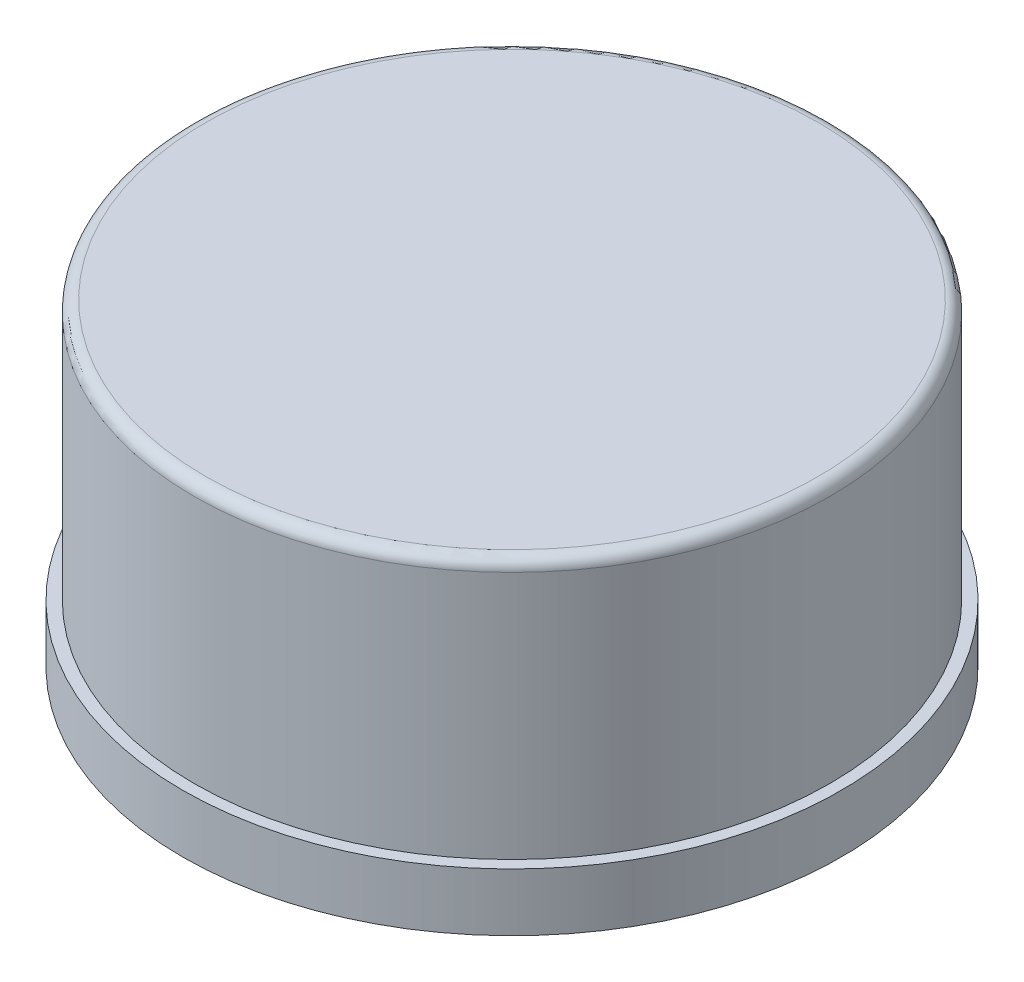
from build123d import *

# Parameters (mm, degrees)
SKETCH7_R           = 5.7
BOSS_EXTRUDE2_DEPTH = 1
SKETCH8_R           = 5.5
BOSS_EXTRUDE3_DEPTH = 4.5
FILLET4_R           = 0.2
SKETCH9_W           = 5
SKETCH9_H           = 5
BOSS_EXTRUDE4_DEPTH = 0.1
SHELL3_T            = -0.6


with BuildPart() as part:
    # Sketch7 → Boss-Extrude2 (new body)
    with BuildSketch(Plane(origin=(0, 0, 0), x_dir=(1, 0, 0), z_dir=(0, 1, 0))):
        with Locations(Location((0, 0, 0), (0, 0, 270))):
            Circle(SKETCH7_R)
    extrude(amount=BOSS_EXTRUDE2_DEPTH)

    # Sketch8 → Boss-Extrude3 (add)
    with BuildSketch(Plane(origin=(0, 1, 0), x_dir=(1, 0, 0), z_dir=(0, 1, 0))):
        with Locations(Location((0, 0, 0), (0, 0, 270))):
            Circle(SKETCH8_R)
    extrude(amount=BOSS_EXTRUDE3_DEPTH)

    # Fillet4
    fillet4_edges = [part.edges().sort_by_distance(p)[0] for p in [
        (0, 5.5, -5.5),
    ]]
    fillet(fillet4_edges, radius=FILLET4_R)

    # Sketch9 → Boss-Extrude4 (add)
    with BuildSketch(Plane.XZ):
        Rectangle(SKETCH9_W, SKETCH9_H)
    extrude(amount=BOSS_EXTRUDE4_DEPTH)

    # Shell3
    shell3_openings = [part.faces().sort_by_distance(p)[0] for p in [
        (0, -0.1, 0),
    ]]
    offset(amount=SHELL3_T, openings=shell3_openings, kind=Kind.INTERSECTION)


solid = part.part
